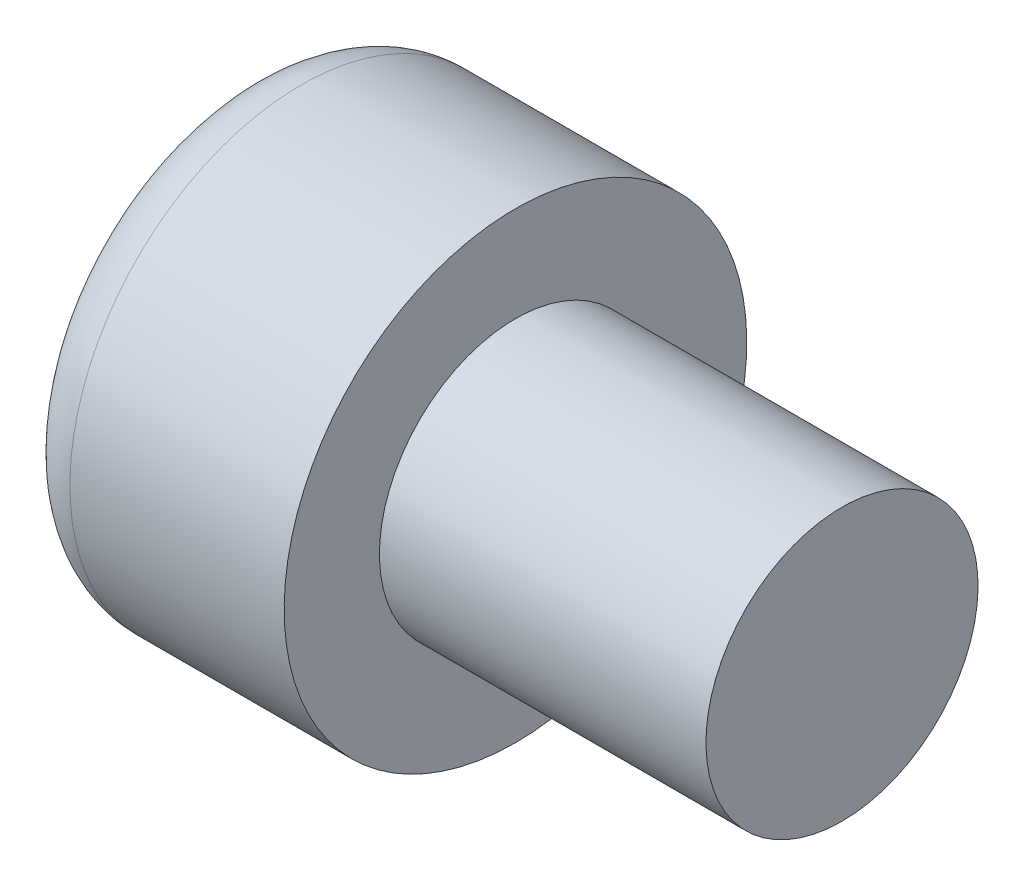
from build123d import *

# Parameters (mm, degrees)
CUT_EXTRUDE1_DEPTH = 2.5


with BuildPart() as part:
    # Sketch1 → Revolve1 (revolve)
    with BuildSketch(Plane.XY, mode=Mode.PRIVATE) as revolve1_sk:
        with BuildLine():
            Line((0, 0), (0, 3.1875))
            ThreePointArc((0, 3.1875), (0.311199045, 3.938800955), (1.0625, 4.25))
            Line((1.0625, 4.25), (5, 4.25))
            Line((5, 4.25), (5, 2.5))
            Line((5, 2.5), (11, 2.5))
            Line((11, 2.5), (11, 0))
            Line((11, 0), (0, 0))
        make_face()
    revolve(revolve1_sk.sketch.rotate(Axis((0, 0, 0), (1, 0, 0)), 180), axis=Axis((0, 0, 0), (1, 0, 0)))

    # Sketch2 → Cut-Extrude1 (cut)
    with BuildSketch(Plane.ZY):
        Polygon((0, 2.309401077), (-2, 1.154700538), (-2, -1.154700538), (0, -2.309401077), (2, -1.154700538), (2, 1.154700538), align=None)
    extrude(amount=-CUT_EXTRUDE1_DEPTH, mode=Mode.SUBTRACT)


solid = part.part
